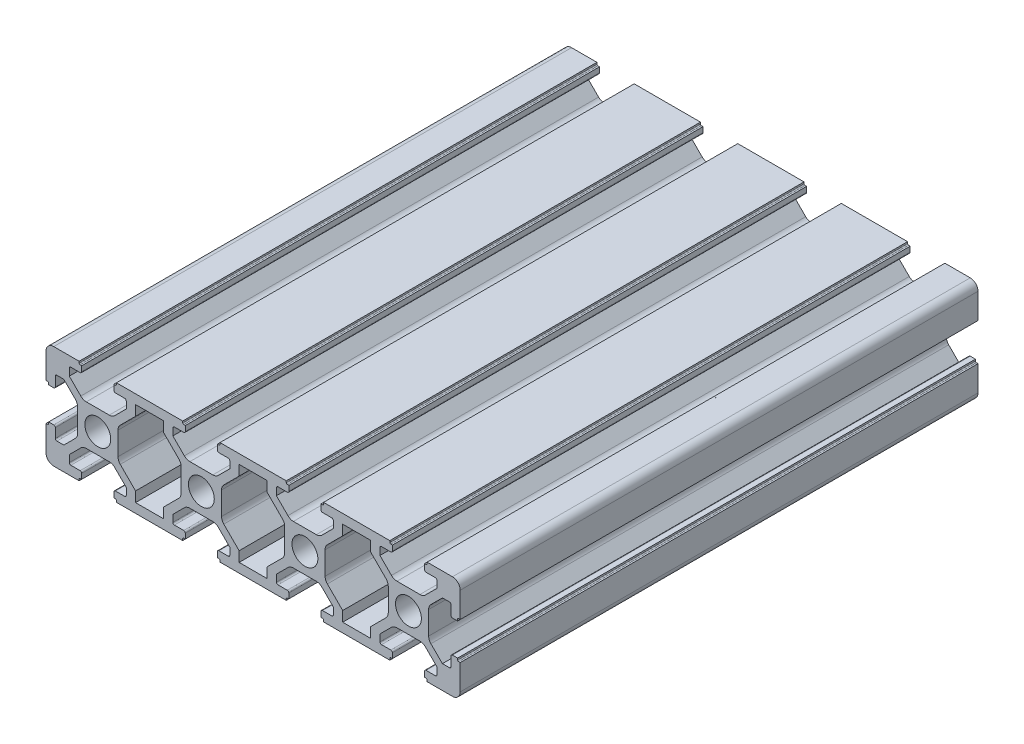
from build123d import *

# Parameters (mm, degrees)
SKETCH_1_R      = 2.5
EXTRUDE_1_DEPTH = 100


with BuildPart() as part:
    # 草图1 → 凸台-拉伸1 (new body)
    with BuildSketch(Plane.XY):
        with BuildLine():
            Line((-30.220998736, 1.536244842), (-35.120998736, 1.536244842))
            Line((-35.120998736, 1.536244842), (-35.120998736, 1.236244842))
            ThreePointArc((-35.120998736, 1.236244842), (-35.17957738, 1.094823486), (-35.320998736, 1.036244842))
            Line((-35.320998736, 1.036244842), (-35.620998736, 1.036244842))
            Line((-35.620998736, 1.036244842), (-35.620998736, 0.036244842))
            ThreePointArc((-35.620998736, 0.036244842), (-35.53313077, -0.175887193), (-35.320998736, -0.263755158))
            Line((-35.320998736, -0.263755158), (-33.520998736, -0.263755158))
            ThreePointArc((-33.520998736, -0.263755158), (-33.308866702, -0.351623124), (-33.220998736, -0.563755158))
            Line((-33.220998736, -0.563755158), (-33.220998736, -1.903755158))
            Line((-33.220998736, -1.903755158), (-35.441658908, -4.12441533))
            ThreePointArc((-35.441658908, -4.12441533), (-35.928293931, -4.449574457), (-36.50231908, -4.563755158))
            Line((-36.50231908, -4.563755158), (-40.939678392, -4.563755158))
            ThreePointArc((-40.939678392, -4.563755158), (-41.513703541, -4.449574457), (-42.000338564, -4.12441533))
            Line((-42.000338564, -4.12441533), (-44.220998736, -1.903755158))
            Line((-44.220998736, -1.903755158), (-44.220998736, -0.563755158))
            ThreePointArc((-44.220998736, -0.563755158), (-44.13313077, -0.351623124), (-43.920998736, -0.263755158))
            Line((-43.920998736, -0.263755158), (-42.120998736, -0.263755158))
            ThreePointArc((-42.120998736, -0.263755158), (-41.908866702, -0.175887193), (-41.820998736, 0.036244842))
            Line((-41.820998736, 0.036244842), (-41.820998736, 1.036244842))
            Line((-41.820998736, 1.036244842), (-42.120998736, 1.036244842))
            ThreePointArc((-42.120998736, 1.036244842), (-42.262420092, 1.094823486), (-42.320998736, 1.236244842))
            Line((-42.320998736, 1.236244842), (-42.320998736, 1.536244842))
            Line((-42.320998736, 1.536244842), (-47.220998736, 1.536244842))
            ThreePointArc((-47.220998736, 1.536244842), (-48.281658908, 1.096905014), (-48.720998736, 0.036244842))
            Line((-48.720998736, 0.036244842), (-48.720998736, -4.863755158))
            Line((-48.720998736, -4.863755158), (-48.420998736, -4.863755158))
            ThreePointArc((-48.420998736, -4.863755158), (-48.27957738, -4.922333802), (-48.220998736, -5.063755158))
            Line((-48.220998736, -5.063755158), (-48.220998736, -5.363755158))
            Line((-48.220998736, -5.363755158), (-47.220998736, -5.363755158))
            ThreePointArc((-47.220998736, -5.363755158), (-47.008866702, -5.275887193), (-46.920998736, -5.063755158))
            Line((-46.920998736, -5.063755158), (-46.920998736, -3.263755158))
            ThreePointArc((-46.920998736, -3.263755158), (-46.83313077, -3.051623124), (-46.620998736, -2.963755158))
            Line((-46.620998736, -2.963755158), (-45.280998736, -2.963755158))
            Line((-45.280998736, -2.963755158), (-43.060338564, -5.18441533))
            ThreePointArc((-43.060338564, -5.18441533), (-42.735179437, -5.671050353), (-42.620998736, -6.245075502))
            Line((-42.620998736, -6.245075502), (-42.620998736, -10.682434815))
            ThreePointArc((-42.620998736, -10.682434815), (-42.735179437, -11.256459963), (-43.060338564, -11.743094986))
            Line((-43.060338564, -11.743094986), (-45.280998736, -13.963755158))
            Line((-45.280998736, -13.963755158), (-46.620998736, -13.963755158))
            ThreePointArc((-46.620998736, -13.963755158), (-46.83313077, -13.875887193), (-46.920998736, -13.663755158))
            Line((-46.920998736, -13.663755158), (-46.920998736, -11.863755158))
            ThreePointArc((-46.920998736, -11.863755158), (-47.008866702, -11.651623124), (-47.220998736, -11.563755158))
            Line((-47.220998736, -11.563755158), (-48.220998736, -11.563755158))
            Line((-48.220998736, -11.563755158), (-48.220998736, -11.863755158))
            ThreePointArc((-48.220998736, -11.863755158), (-48.27957738, -12.005176514), (-48.420998736, -12.063755158))
            Line((-48.420998736, -12.063755158), (-48.720998736, -12.063755158))
            Line((-48.720998736, -12.063755158), (-48.720998736, -16.963755158))
            ThreePointArc((-48.720998736, -16.963755158), (-48.281658908, -18.02441533), (-47.220998736, -18.463755158))
            Line((-47.220998736, -18.463755158), (-42.320998736, -18.463755158))
            Line((-42.320998736, -18.463755158), (-42.320998736, -18.163755158))
            ThreePointArc((-42.320998736, -18.163755158), (-42.262420092, -18.022333802), (-42.120998736, -17.963755158))
            Line((-42.120998736, -17.963755158), (-41.820998736, -17.963755158))
            Line((-41.820998736, -17.963755158), (-41.820998736, -16.963755158))
            ThreePointArc((-41.820998736, -16.963755158), (-41.908866702, -16.751623124), (-42.120998736, -16.663755158))
            Line((-42.120998736, -16.663755158), (-43.920998736, -16.663755158))
            ThreePointArc((-43.920998736, -16.663755158), (-44.13313077, -16.575887193), (-44.220998736, -16.363755158))
            Line((-44.220998736, -16.363755158), (-44.220998736, -15.023755158))
            Line((-44.220998736, -15.023755158), (-42.000338564, -12.803094986))
            ThreePointArc((-42.000338564, -12.803094986), (-41.513703541, -12.477935859), (-40.939678392, -12.363755158))
            Line((-40.939678392, -12.363755158), (-36.50231908, -12.363755158))
            ThreePointArc((-36.50231908, -12.363755158), (-35.928293931, -12.477935859), (-35.441658908, -12.803094986))
            Line((-35.441658908, -12.803094986), (-33.220998736, -15.023755158))
            Line((-33.220998736, -15.023755158), (-33.220998736, -16.363755158))
            ThreePointArc((-33.220998736, -16.363755158), (-33.308866702, -16.575887193), (-33.520998736, -16.663755158))
            Line((-33.520998736, -16.663755158), (-35.320998736, -16.663755158))
            ThreePointArc((-35.320998736, -16.663755158), (-35.53313077, -16.751623124), (-35.620998736, -16.963755158))
            Line((-35.620998736, -16.963755158), (-35.620998736, -17.963755158))
            Line((-35.620998736, -17.963755158), (-35.320998736, -17.963755158))
            ThreePointArc((-35.320998736, -17.963755158), (-35.17957738, -18.022333802), (-35.120998736, -18.163755158))
            Line((-35.120998736, -18.163755158), (-35.120998736, -18.463755158))
            Line((-35.120998736, -18.463755158), (-30.220998736, -18.463755158))
            Line((-30.220998736, -18.463755158), (-22.320998736, -18.463755158))
            Line((-22.320998736, -18.463755158), (-22.320998736, -18.163755158))
            ThreePointArc((-22.320998736, -18.163755158), (-22.262420092, -18.022333802), (-22.120998736, -17.963755158))
            Line((-22.120998736, -17.963755158), (-21.820998736, -17.963755158))
            Line((-21.820998736, -17.963755158), (-21.820998736, -16.963755158))
            ThreePointArc((-21.820998736, -16.963755158), (-21.908866702, -16.751623124), (-22.120998736, -16.663755158))
            Line((-22.120998736, -16.663755158), (-23.920998736, -16.663755158))
            ThreePointArc((-23.920998736, -16.663755158), (-24.13313077, -16.575887193), (-24.220998736, -16.363755158))
            Line((-24.220998736, -16.363755158), (-24.220998736, -15.023755158))
            Line((-24.220998736, -15.023755158), (-22.000338564, -12.803094986))
            ThreePointArc((-22.000338564, -12.803094986), (-21.513703541, -12.477935859), (-20.939678392, -12.363755158))
            Line((-20.939678392, -12.363755158), (-16.50231908, -12.363755158))
            ThreePointArc((-16.50231908, -12.363755158), (-15.928293931, -12.477935859), (-15.441658908, -12.803094986))
            Line((-15.441658908, -12.803094986), (-13.220998736, -15.023755158))
            Line((-13.220998736, -15.023755158), (-13.220998736, -16.363755158))
            ThreePointArc((-13.220998736, -16.363755158), (-13.308866702, -16.575887193), (-13.520998736, -16.663755158))
            Line((-13.520998736, -16.663755158), (-15.320998736, -16.663755158))
            ThreePointArc((-15.320998736, -16.663755158), (-15.53313077, -16.751623124), (-15.620998736, -16.963755158))
            Line((-15.620998736, -16.963755158), (-15.620998736, -17.963755158))
            Line((-15.620998736, -17.963755158), (-15.320998736, -17.963755158))
            ThreePointArc((-15.320998736, -17.963755158), (-15.17957738, -18.022333802), (-15.120998736, -18.163755158))
            Line((-15.120998736, -18.163755158), (-15.120998736, -18.463755158))
            Line((-15.120998736, -18.463755158), (-10.220998736, -18.463755158))
            Line((-10.220998736, -18.463755158), (-2.320998736, -18.463755158))
            Line((-2.320998736, -18.463755158), (-2.320998736, -18.163755158))
            ThreePointArc((-2.320998736, -18.163755158), (-2.262420092, -18.022333802), (-2.120998736, -17.963755158))
            Line((-2.120998736, -17.963755158), (-1.820998736, -17.963755158))
            Line((-1.820998736, -17.963755158), (-1.820998736, -16.963755158))
            ThreePointArc((-1.820998736, -16.963755158), (-1.908866702, -16.751623124), (-2.120998736, -16.663755158))
            Line((-2.120998736, -16.663755158), (-3.920998736, -16.663755158))
            ThreePointArc((-3.920998736, -16.663755158), (-4.13313077, -16.575887193), (-4.220998736, -16.363755158))
            Line((-4.220998736, -16.363755158), (-4.220998736, -15.023755158))
            Line((-4.220998736, -15.023755158), (-2.000338564, -12.803094986))
            ThreePointArc((-2.000338564, -12.803094986), (-1.513703541, -12.477935859), (-0.939678392, -12.363755158))
            Line((-0.939678392, -12.363755158), (3.49768092, -12.363755158))
            ThreePointArc((3.49768092, -12.363755158), (4.071706069, -12.477935859), (4.558341092, -12.803094986))
            Line((4.558341092, -12.803094986), (6.779001264, -15.023755158))
            Line((6.779001264, -15.023755158), (6.779001264, -16.363755158))
            ThreePointArc((6.779001264, -16.363755158), (6.691133298, -16.575887193), (6.479001264, -16.663755158))
            Line((6.479001264, -16.663755158), (4.679001264, -16.663755158))
            ThreePointArc((4.679001264, -16.663755158), (4.46686923, -16.751623124), (4.379001264, -16.963755158))
            Line((4.379001264, -16.963755158), (4.379001264, -17.963755158))
            Line((4.379001264, -17.963755158), (4.679001264, -17.963755158))
            ThreePointArc((4.679001264, -17.963755158), (4.82042262, -18.022333802), (4.879001264, -18.163755158))
            Line((4.879001264, -18.163755158), (4.879001264, -18.463755158))
            Line((4.879001264, -18.463755158), (9.779001264, -18.463755158))
            Line((9.779001264, -18.463755158), (17.679001264, -18.463755158))
            Line((17.679001264, -18.463755158), (17.679001264, -18.163755158))
            ThreePointArc((17.679001264, -18.163755158), (17.737579908, -18.022333802), (17.879001264, -17.963755158))
            Line((17.879001264, -17.963755158), (18.179001264, -17.963755158))
            Line((18.179001264, -17.963755158), (18.179001264, -16.963755158))
            ThreePointArc((18.179001264, -16.963755158), (18.091133298, -16.751623124), (17.879001264, -16.663755158))
            Line((17.879001264, -16.663755158), (16.079001264, -16.663755158))
            ThreePointArc((16.079001264, -16.663755158), (15.86686923, -16.575887193), (15.779001264, -16.363755158))
            Line((15.779001264, -16.363755158), (15.779001264, -15.023755158))
            Line((15.779001264, -15.023755158), (17.999661436, -12.803094986))
            ThreePointArc((17.999661436, -12.803094986), (18.486296459, -12.477935859), (19.060321608, -12.363755158))
            Line((19.060321608, -12.363755158), (23.49768092, -12.363755158))
            ThreePointArc((23.49768092, -12.363755158), (24.071706069, -12.477935859), (24.558341092, -12.803094986))
            Line((24.558341092, -12.803094986), (26.779001264, -15.023755158))
            Line((26.779001264, -15.023755158), (26.779001264, -16.363755158))
            ThreePointArc((26.779001264, -16.363755158), (26.691133298, -16.575887193), (26.479001264, -16.663755158))
            Line((26.479001264, -16.663755158), (24.679001264, -16.663755158))
            ThreePointArc((24.679001264, -16.663755158), (24.46686923, -16.751623124), (24.379001264, -16.963755158))
            Line((24.379001264, -16.963755158), (24.379001264, -17.963755158))
            Line((24.379001264, -17.963755158), (24.679001264, -17.963755158))
            ThreePointArc((24.679001264, -17.963755158), (24.82042262, -18.022333802), (24.879001264, -18.163755158))
            Line((24.879001264, -18.163755158), (24.879001264, -18.463755158))
            Line((24.879001264, -18.463755158), (29.779001264, -18.463755158))
            ThreePointArc((29.779001264, -18.463755158), (30.839661436, -18.02441533), (31.279001264, -16.963755158))
            Line((31.279001264, -16.963755158), (31.279001264, -12.063755158))
            Line((31.279001264, -12.063755158), (30.979001264, -12.063755158))
            ThreePointArc((30.979001264, -12.063755158), (30.837579908, -12.005176514), (30.779001264, -11.863755158))
            Line((30.779001264, -11.863755158), (30.779001264, -11.563755158))
            Line((30.779001264, -11.563755158), (29.779001264, -11.563755158))
            ThreePointArc((29.779001264, -11.563755158), (29.56686923, -11.651623124), (29.479001264, -11.863755158))
            Line((29.479001264, -11.863755158), (29.479001264, -13.663755158))
            ThreePointArc((29.479001264, -13.663755158), (29.391133298, -13.875887193), (29.179001264, -13.963755158))
            Line((29.179001264, -13.963755158), (27.839001264, -13.963755158))
            Line((27.839001264, -13.963755158), (25.618341092, -11.743094986))
            ThreePointArc((25.618341092, -11.743094986), (25.293181965, -11.256459963), (25.179001264, -10.682434815))
            Line((25.179001264, -10.682434815), (25.179001264, -6.245075502))
            ThreePointArc((25.179001264, -6.245075502), (25.293181965, -5.671050353), (25.618341092, -5.18441533))
            Line((25.618341092, -5.18441533), (27.839001264, -2.963755158))
            Line((27.839001264, -2.963755158), (29.179001264, -2.963755158))
            ThreePointArc((29.179001264, -2.963755158), (29.391133298, -3.051623124), (29.479001264, -3.263755158))
            Line((29.479001264, -3.263755158), (29.479001264, -5.063755158))
            ThreePointArc((29.479001264, -5.063755158), (29.56686923, -5.275887193), (29.779001264, -5.363755158))
            Line((29.779001264, -5.363755158), (30.779001264, -5.363755158))
            Line((30.779001264, -5.363755158), (30.779001264, -5.063755158))
            ThreePointArc((30.779001264, -5.063755158), (30.837579908, -4.922333802), (30.979001264, -4.863755158))
            Line((30.979001264, -4.863755158), (31.279001264, -4.863755158))
            Line((31.279001264, -4.863755158), (31.279001264, 0.036244842))
            ThreePointArc((31.279001264, 0.036244842), (30.839661436, 1.096905014), (29.779001264, 1.536244842))
            Line((29.779001264, 1.536244842), (24.879001264, 1.536244842))
            Line((24.879001264, 1.536244842), (24.879001264, 1.236244842))
            ThreePointArc((24.879001264, 1.236244842), (24.82042262, 1.094823486), (24.679001264, 1.036244842))
            Line((24.679001264, 1.036244842), (24.379001264, 1.036244842))
            Line((24.379001264, 1.036244842), (24.379001264, 0.036244842))
            ThreePointArc((24.379001264, 0.036244842), (24.46686923, -0.175887193), (24.679001264, -0.263755158))
            Line((24.679001264, -0.263755158), (26.479001264, -0.263755158))
            ThreePointArc((26.479001264, -0.263755158), (26.691133298, -0.351623124), (26.779001264, -0.563755158))
            Line((26.779001264, -0.563755158), (26.779001264, -1.903755158))
            Line((26.779001264, -1.903755158), (24.558341092, -4.12441533))
            ThreePointArc((24.558341092, -4.12441533), (24.071706069, -4.449574457), (23.49768092, -4.563755158))
            Line((23.49768092, -4.563755158), (19.060321608, -4.563755158))
            ThreePointArc((19.060321608, -4.563755158), (18.486296459, -4.449574457), (17.999661436, -4.12441533))
            Line((17.999661436, -4.12441533), (15.779001264, -1.903755158))
            Line((15.779001264, -1.903755158), (15.779001264, -0.563755158))
            ThreePointArc((15.779001264, -0.563755158), (15.86686923, -0.351623124), (16.079001264, -0.263755158))
            Line((16.079001264, -0.263755158), (17.879001264, -0.263755158))
            ThreePointArc((17.879001264, -0.263755158), (18.091133298, -0.175887193), (18.179001264, 0.036244842))
            Line((18.179001264, 0.036244842), (18.179001264, 1.036244842))
            Line((18.179001264, 1.036244842), (17.879001264, 1.036244842))
            ThreePointArc((17.879001264, 1.036244842), (17.737579908, 1.094823486), (17.679001264, 1.236244842))
            Line((17.679001264, 1.236244842), (17.679001264, 1.536244842))
            Line((17.679001264, 1.536244842), (12.779001264, 1.536244842))
            Line((12.779001264, 1.536244842), (9.779001264, 1.536244842))
            Line((9.779001264, 1.536244842), (4.879001264, 1.536244842))
            Line((4.879001264, 1.536244842), (4.879001264, 1.236244842))
            ThreePointArc((4.879001264, 1.236244842), (4.82042262, 1.094823486), (4.679001264, 1.036244842))
            Line((4.679001264, 1.036244842), (4.379001264, 1.036244842))
            Line((4.379001264, 1.036244842), (4.379001264, 0.036244842))
            ThreePointArc((4.379001264, 0.036244842), (4.46686923, -0.175887193), (4.679001264, -0.263755158))
            Line((4.679001264, -0.263755158), (6.479001264, -0.263755158))
            ThreePointArc((6.479001264, -0.263755158), (6.691133298, -0.351623124), (6.779001264, -0.563755158))
            Line((6.779001264, -0.563755158), (6.779001264, -1.903755158))
            Line((6.779001264, -1.903755158), (4.558341092, -4.12441533))
            ThreePointArc((4.558341092, -4.12441533), (4.071706069, -4.449574457), (3.49768092, -4.563755158))
            Line((3.49768092, -4.563755158), (-0.939678392, -4.563755158))
            ThreePointArc((-0.939678392, -4.563755158), (-1.513703541, -4.449574457), (-2.000338564, -4.12441533))
            Line((-2.000338564, -4.12441533), (-4.220998736, -1.903755158))
            Line((-4.220998736, -1.903755158), (-4.220998736, -0.563755158))
            ThreePointArc((-4.220998736, -0.563755158), (-4.13313077, -0.351623124), (-3.920998736, -0.263755158))
            Line((-3.920998736, -0.263755158), (-2.120998736, -0.263755158))
            ThreePointArc((-2.120998736, -0.263755158), (-1.908866702, -0.175887193), (-1.820998736, 0.036244842))
            Line((-1.820998736, 0.036244842), (-1.820998736, 1.036244842))
            Line((-1.820998736, 1.036244842), (-2.120998736, 1.036244842))
            ThreePointArc((-2.120998736, 1.036244842), (-2.262420092, 1.094823486), (-2.320998736, 1.236244842))
            Line((-2.320998736, 1.236244842), (-2.320998736, 1.536244842))
            Line((-2.320998736, 1.536244842), (-10.220998736, 1.536244842))
            Line((-10.220998736, 1.536244842), (-15.120998736, 1.536244842))
            Line((-15.120998736, 1.536244842), (-15.120998736, 1.236244842))
            ThreePointArc((-15.120998736, 1.236244842), (-15.17957738, 1.094823486), (-15.320998736, 1.036244842))
            Line((-15.320998736, 1.036244842), (-15.620998736, 1.036244842))
            Line((-15.620998736, 1.036244842), (-15.620998736, 0.036244842))
            ThreePointArc((-15.620998736, 0.036244842), (-15.53313077, -0.175887193), (-15.320998736, -0.263755158))
            Line((-15.320998736, -0.263755158), (-13.520998736, -0.263755158))
            ThreePointArc((-13.520998736, -0.263755158), (-13.308866702, -0.351623124), (-13.220998736, -0.563755158))
            Line((-13.220998736, -0.563755158), (-13.220998736, -1.903755158))
            Line((-13.220998736, -1.903755158), (-15.441658908, -4.12441533))
            ThreePointArc((-15.441658908, -4.12441533), (-15.928293931, -4.449574457), (-16.50231908, -4.563755158))
            Line((-16.50231908, -4.563755158), (-20.939678392, -4.563755158))
            ThreePointArc((-20.939678392, -4.563755158), (-21.513703541, -4.449574457), (-22.000338564, -4.12441533))
            Line((-22.000338564, -4.12441533), (-24.220998736, -1.903755158))
            Line((-24.220998736, -1.903755158), (-24.220998736, -0.563755158))
            ThreePointArc((-24.220998736, -0.563755158), (-24.13313077, -0.351623124), (-23.920998736, -0.263755158))
            Line((-23.920998736, -0.263755158), (-22.120998736, -0.263755158))
            ThreePointArc((-22.120998736, -0.263755158), (-21.908866702, -0.175887193), (-21.820998736, 0.036244842))
            Line((-21.820998736, 0.036244842), (-21.820998736, 1.036244842))
            Line((-21.820998736, 1.036244842), (-22.120998736, 1.036244842))
            ThreePointArc((-22.120998736, 1.036244842), (-22.262420092, 1.094823486), (-22.320998736, 1.236244842))
            Line((-22.320998736, 1.236244842), (-22.320998736, 1.536244842))
            Line((-22.320998736, 1.536244842), (-27.220998736, 1.536244842))
            Line((-27.220998736, 1.536244842), (-30.220998736, 1.536244842))
        make_face()
        with Locations((21.279001264, -8.463755158)):
            Circle(SKETCH_1_R, mode=Mode.SUBTRACT)
        with Locations((-38.720998736, -8.463755158)):
            Circle(SKETCH_1_R, mode=Mode.SUBTRACT)
        with Locations((1.279001264, -8.463755158)):
            Circle(SKETCH_1_R, mode=Mode.SUBTRACT)
        with Locations((-18.720998736, -8.463755158)):
            Circle(SKETCH_1_R, mode=Mode.SUBTRACT)
        with BuildLine():
            Line((-31.420998736, -14.703755158), (-34.381658908, -11.743094986))
            ThreePointArc((-34.381658908, -11.743094986), (-34.706818035, -11.256459963), (-34.820998736, -10.682434815))
            Line((-34.820998736, -10.682434815), (-34.820998736, -6.245075502))
            ThreePointArc((-34.820998736, -6.245075502), (-34.706818035, -5.671050353), (-34.381658908, -5.18441533))
            Line((-34.381658908, -5.18441533), (-31.420998736, -2.223755158))
            Line((-31.420998736, -2.223755158), (-31.420998736, -0.263755158))
            Line((-31.420998736, -0.263755158), (-26.020998736, -0.263755158))
            Line((-26.020998736, -0.263755158), (-26.020998736, -2.223755158))
            Line((-26.020998736, -2.223755158), (-23.060338564, -5.18441533))
            ThreePointArc((-23.060338564, -5.18441533), (-22.735179437, -5.671050353), (-22.620998736, -6.245075502))
            Line((-22.620998736, -6.245075502), (-22.620998736, -10.682434815))
            ThreePointArc((-22.620998736, -10.682434815), (-22.735179437, -11.256459963), (-23.060338564, -11.743094986))
            Line((-23.060338564, -11.743094986), (-26.020998736, -14.703755158))
            Line((-26.020998736, -14.703755158), (-26.020998736, -16.663755158))
            Line((-26.020998736, -16.663755158), (-31.420998736, -16.663755158))
            Line((-31.420998736, -16.663755158), (-31.420998736, -14.703755158))
        make_face(mode=Mode.SUBTRACT)
        with BuildLine():
            Line((-14.820998736, -10.682434815), (-14.820998736, -6.245075502))
            ThreePointArc((-14.820998736, -6.245075502), (-14.706818035, -5.671050353), (-14.381658908, -5.18441533))
            Line((-14.381658908, -5.18441533), (-11.420998736, -2.223755158))
            Line((-11.420998736, -2.223755158), (-11.420998736, -0.263755158))
            Line((-11.420998736, -0.263755158), (-6.020998736, -0.263755158))
            Line((-6.020998736, -0.263755158), (-6.020998736, -2.223755158))
            Line((-6.020998736, -2.223755158), (-3.060338564, -5.18441533))
            ThreePointArc((-3.060338564, -5.18441533), (-2.735179437, -5.671050353), (-2.620998736, -6.245075502))
            Line((-2.620998736, -6.245075502), (-2.620998736, -10.682434815))
            ThreePointArc((-2.620998736, -10.682434815), (-2.735179437, -11.256459963), (-3.060338564, -11.743094986))
            Line((-3.060338564, -11.743094986), (-6.020998736, -14.703755158))
            Line((-6.020998736, -14.703755158), (-6.020998736, -16.663755158))
            Line((-6.020998736, -16.663755158), (-11.420998736, -16.663755158))
            Line((-11.420998736, -16.663755158), (-11.420998736, -14.703755158))
            Line((-11.420998736, -14.703755158), (-14.381658908, -11.743094986))
            ThreePointArc((-14.381658908, -11.743094986), (-14.706818035, -11.256459963), (-14.820998736, -10.682434815))
        make_face(mode=Mode.SUBTRACT)
        with BuildLine():
            Line((5.618341092, -5.18441533), (8.579001264, -2.223755158))
            Line((8.579001264, -2.223755158), (8.579001264, -0.263755158))
            Line((8.579001264, -0.263755158), (13.979001264, -0.263755158))
            Line((13.979001264, -0.263755158), (13.979001264, -2.223755158))
            Line((13.979001264, -2.223755158), (16.939661436, -5.18441533))
            ThreePointArc((16.939661436, -5.18441533), (17.264820563, -5.671050353), (17.379001264, -6.245075502))
            Line((17.379001264, -6.245075502), (17.379001264, -10.682434815))
            ThreePointArc((17.379001264, -10.682434815), (17.264820563, -11.256459963), (16.939661436, -11.743094986))
            Line((16.939661436, -11.743094986), (13.979001264, -14.703755158))
            Line((13.979001264, -14.703755158), (13.979001264, -16.663755158))
            Line((13.979001264, -16.663755158), (8.579001264, -16.663755158))
            Line((8.579001264, -16.663755158), (8.579001264, -14.703755158))
            Line((8.579001264, -14.703755158), (5.618341092, -11.743094986))
            ThreePointArc((5.618341092, -11.743094986), (5.293181965, -11.256459963), (5.179001264, -10.682434815))
            Line((5.179001264, -10.682434815), (5.179001264, -6.245075502))
            ThreePointArc((5.179001264, -6.245075502), (5.293181965, -5.671050353), (5.618341092, -5.18441533))
        make_face(mode=Mode.SUBTRACT)
    extrude(amount=EXTRUDE_1_DEPTH)


solid = part.part
